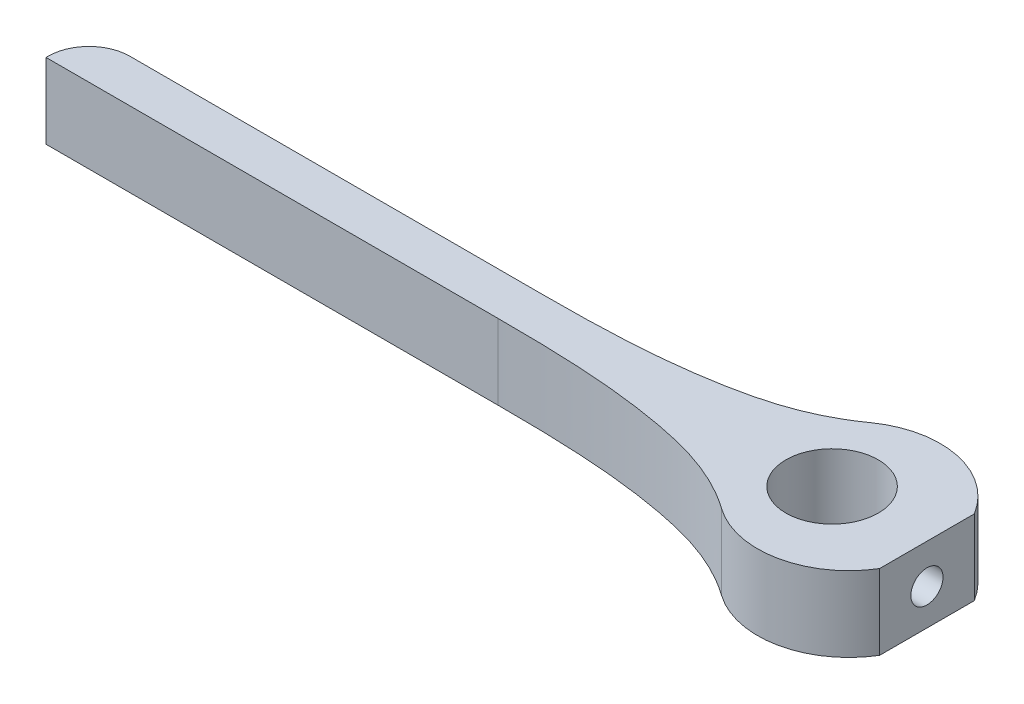
from build123d import *

# Parameters (mm, degrees)
SKETCH1_R               = 4.3
BOSS_EXTRUDE1_DEPTH     = 7
CUT_EXTRUDE1_REACH      = 82.754
CUT_EXTRUDE1_END_RADIUS = 4.3
SKETCH2_R               = 1.496285127
CUT_EXTRUDE3_START      = -7
CUT_EXTRUDE3_DEPTH      = 4.5


with BuildPart() as part:
    # Sketch1 → Boss-Extrude1 (new body)
    with BuildSketch(Plane(origin=(0, 0, 0), x_dir=(1, 0, 0), z_dir=(0, 1, 0))):
        with BuildLine():
            Line((-71.170433536, -2), (-29.082351877, -2))
            add(Edge.make_bspline(
                [(-29.082351877, -2), (-23.609649847, -2), (-15.245438708, -2.238584536), (-6.627824546, -4.603953255), (-3.36619416, -6.925224681)],
                knots=[0, 0, 0, 0, 0.607849165, 1, 1, 1, 1], degree=3))
            ThreePointArc((-3.36619416, -6.925224681), (3.28001342, -8.324655054), (8.829566464, -4.408925038))
            Line((8.829566464, -4.408925038), (8.829566464, 4.408925038))
            ThreePointArc((8.829566464, 4.408925038), (3.28001342, 8.324655054), (-3.36619416, 6.925224681))
            add(Edge.make_bspline(
                [(-29.082351877, 2), (-23.609649847, 2), (-15.245438708, 2.238584536), (-6.627824546, 4.603953255), (-3.36619416, 6.925224681)],
                knots=[0, 0, 0, 0, 0.607849165, 1, 1, 1, 1], degree=3))
            Line((-29.082351877, 2), (-67.370433536, 2))
            ThreePointArc((-67.370433536, 2), (-70.057439304, 0.887005769), (-71.170433536, -1.8))
            Line((-71.170433536, -1.8), (-71.170433536, -2))
        make_face()
        with Locations(Location((0, 0, 0), (0, 0, 270))):
            Circle(SKETCH1_R, mode=Mode.SUBTRACT)
    extrude(amount=BOSS_EXTRUDE1_DEPTH)

    # Cut-Extrude1: up to this cylinder (the profile starts outside it)
    cut_extrude1_end = Plane(origin=(0, 3.358684, 0), z_dir=(0, -1, 0)) * Cylinder(CUT_EXTRUDE1_END_RADIUS, 175.108, mode=Mode.PRIVATE)
    # Sketch2 → Cut-Extrude1 (cut, up to the surface)
    with BuildSketch(Plane(origin=(8.829566464, 0, 0), x_dir=(0, 0, -1), z_dir=(1, 0, 0)), mode=Mode.PRIVATE) as cut_extrude1_sk1:
        with Locations((0, 3.358684182)):
            Circle(SKETCH2_R)
    cut_extrude1_tool1 = extrude(cut_extrude1_sk1.sketch, amount=-CUT_EXTRUDE1_REACH, mode=Mode.PRIVATE) - cut_extrude1_end
    add(cut_extrude1_tool1.solids().sort_by_distance((8.829566, 3.358684, 0))[0], mode=Mode.SUBTRACT)

    # Sketch3 → Cut-Extrude3 (cut)
    with BuildSketch(Plane(origin=(8.829566464, 0, 0), x_dir=(0, 0, -1), z_dir=(1, 0, 0)).offset(CUT_EXTRUDE3_START)):
        Polygon((-1.615510912, 0.560537202), (1.615510912, 0.560537202), (3.231021825, 3.358684182), (1.615510912, 6.156831163), (-1.615510912, 6.156831163), (-3.231021825, 3.358684182), align=None)
    extrude(amount=CUT_EXTRUDE3_DEPTH, mode=Mode.SUBTRACT)


solid = part.part
